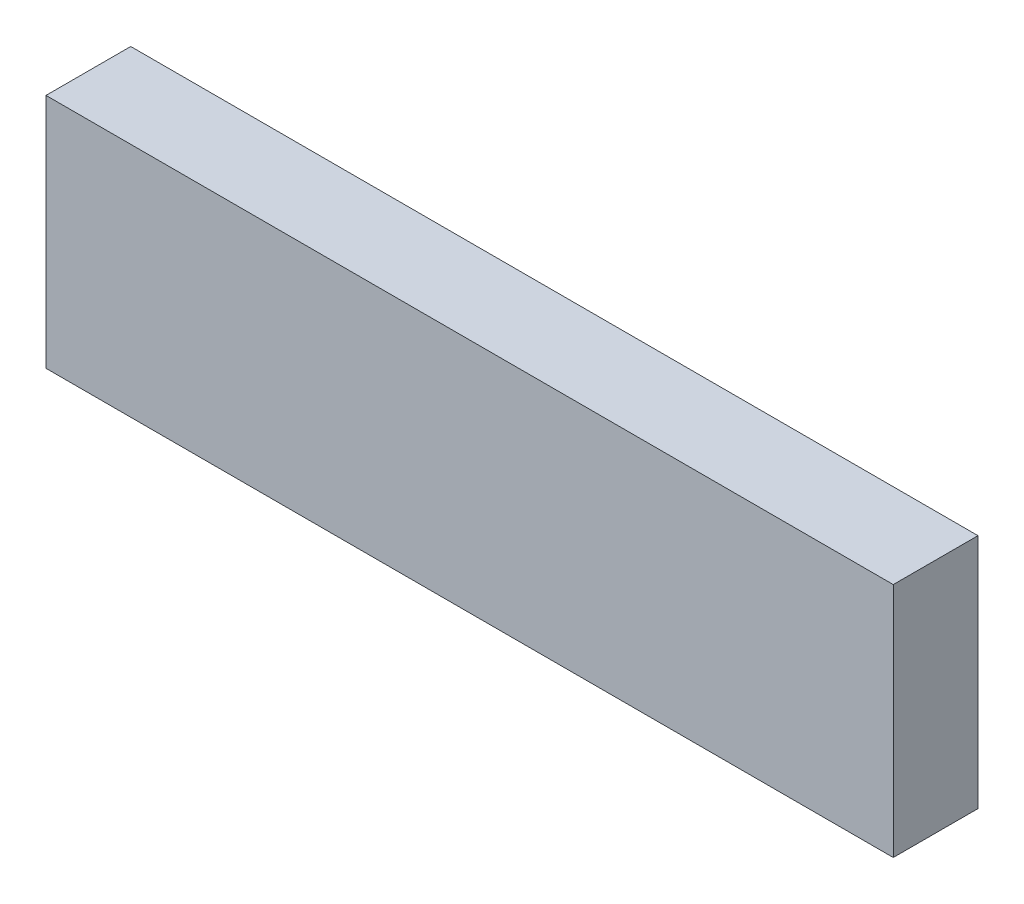
from build123d import *

# Parameters (mm, degrees)
ESQUISSE1_W        = 50
ESQUISSE1_H        = 13.95
BOSS_EXTRU_1_DEPTH = 5


with BuildPart() as part:
    # Esquisse1 → Boss.-Extru.1 (new body)
    with BuildSketch(Plane.XY):
        with Locations((25, 6.975)):
            Rectangle(ESQUISSE1_W, ESQUISSE1_H)
    extrude(amount=BOSS_EXTRU_1_DEPTH)


solid = part.part
